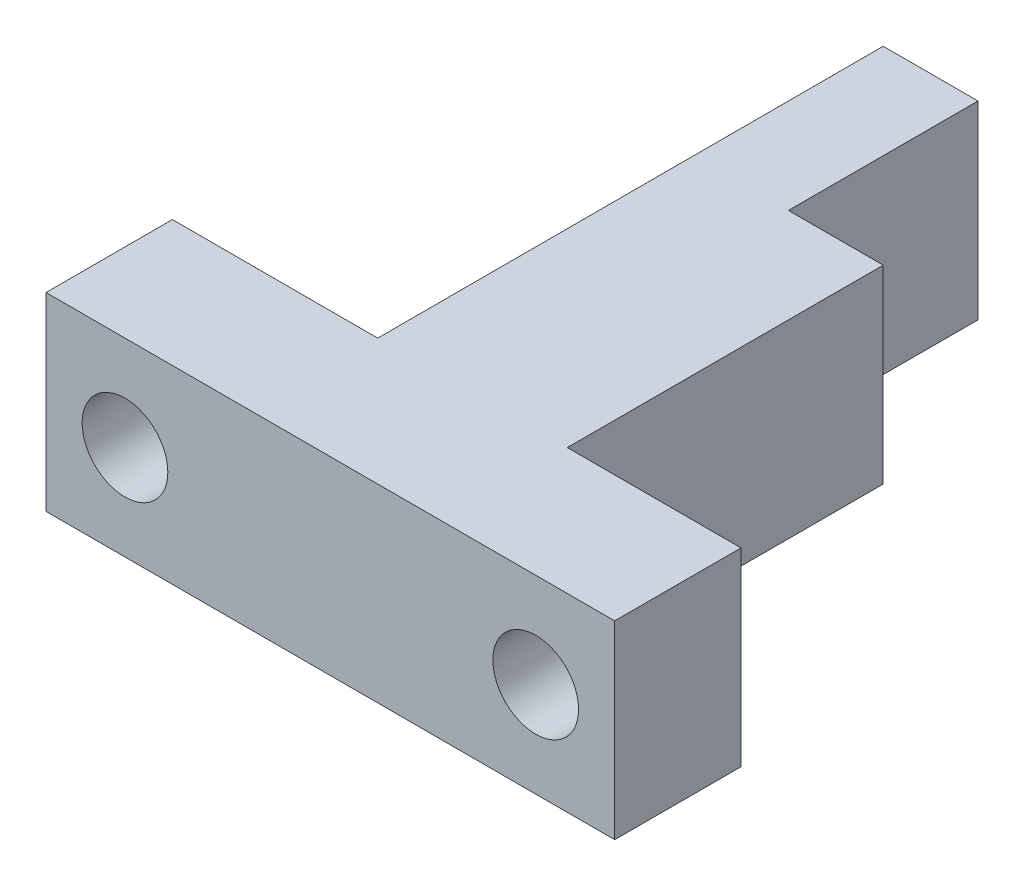
from build123d import *

# Parameters (mm, degrees)
BOSS_EXTRUDE1_DEPTH = 9.525
SKETCH3_R           = 2.15265
CUT_EXTRUDE1_DEPTH  = 37.095993978


with BuildPart() as part:
    # Sketch2 → Boss-Extrude1 (new body)
    with BuildSketch(Plane(origin=(0, 0, 0), x_dir=(1, 0, 0), z_dir=(0, 1, 0))):
        Polygon((-14.2875, 0), (14.2875, 0), (14.2875, 6.35), (5.55625, 6.35), (5.55625, 22.225), (0.79375, 22.225), (0.79375, 31.75), (-3.96875, 31.75), (-3.96875, 6.35), (-14.2875, 6.35), align=None)
    extrude(amount=BOSS_EXTRUDE1_DEPTH)

    # Sketch3 → Cut-Extrude1 (cut, through all)
    with BuildSketch(Plane.XY):
        with Locations((-10.31875, 4.7625)):
            Circle(SKETCH3_R)
        with Locations((10.31875, 4.7625)):
            Circle(SKETCH3_R)
    extrude(amount=-CUT_EXTRUDE1_DEPTH, mode=Mode.SUBTRACT)


solid = part.part
